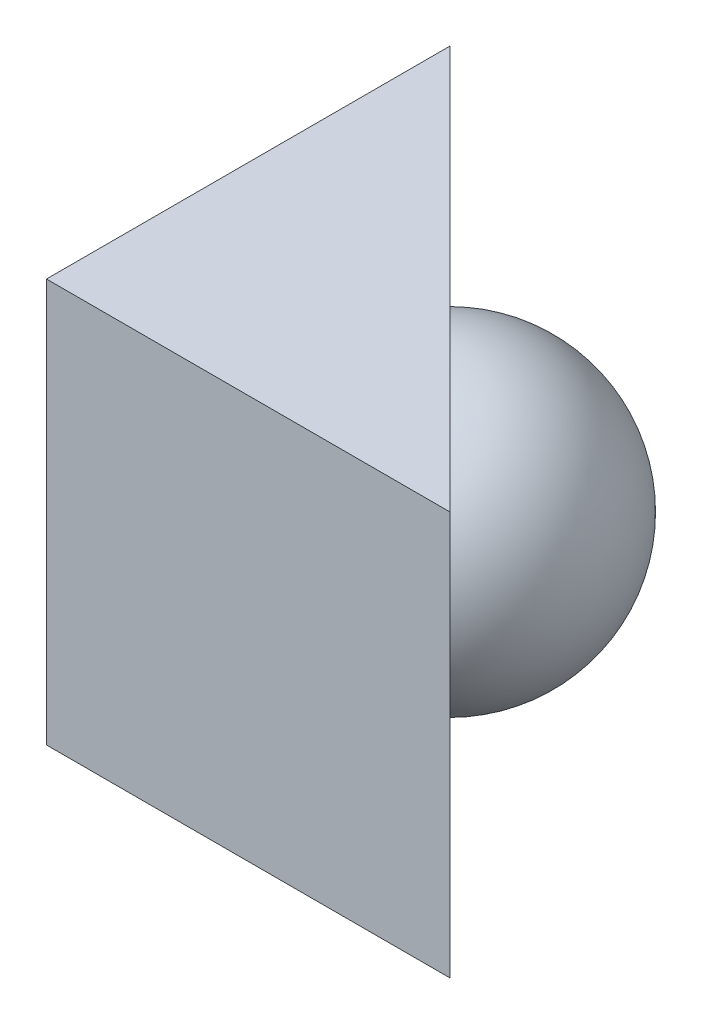
from build123d import *

# Parameters (mm, degrees)
BOSS_EXTRUDE1_DEPTH = 25


with BuildPart() as part:
    # Sketch2 → Revolve1 (revolve)
    with BuildSketch(Plane(origin=(0, 0, 0), x_dir=(1, 0, 0), z_dir=(0, 1, 0))):
        with BuildLine():
            Line((-18, 0), (18, 0))
            ThreePointArc((18, 0), (0, 18), (-18, 0))
        make_face()
    revolve(axis=Axis((-18, 0, 0), (1, 0, 0)))

    # Sketch3 → Boss-Extrude1 (add, symmetric)
    with BuildSketch(Plane(origin=(0, 0, 0), x_dir=(1, 0, 0), z_dir=(0, 1, 0))):
        Polygon((25, -25), (-25, 25), (-25, -25), align=None)
    extrude(amount=BOSS_EXTRUDE1_DEPTH, both=True)


solid = part.part
